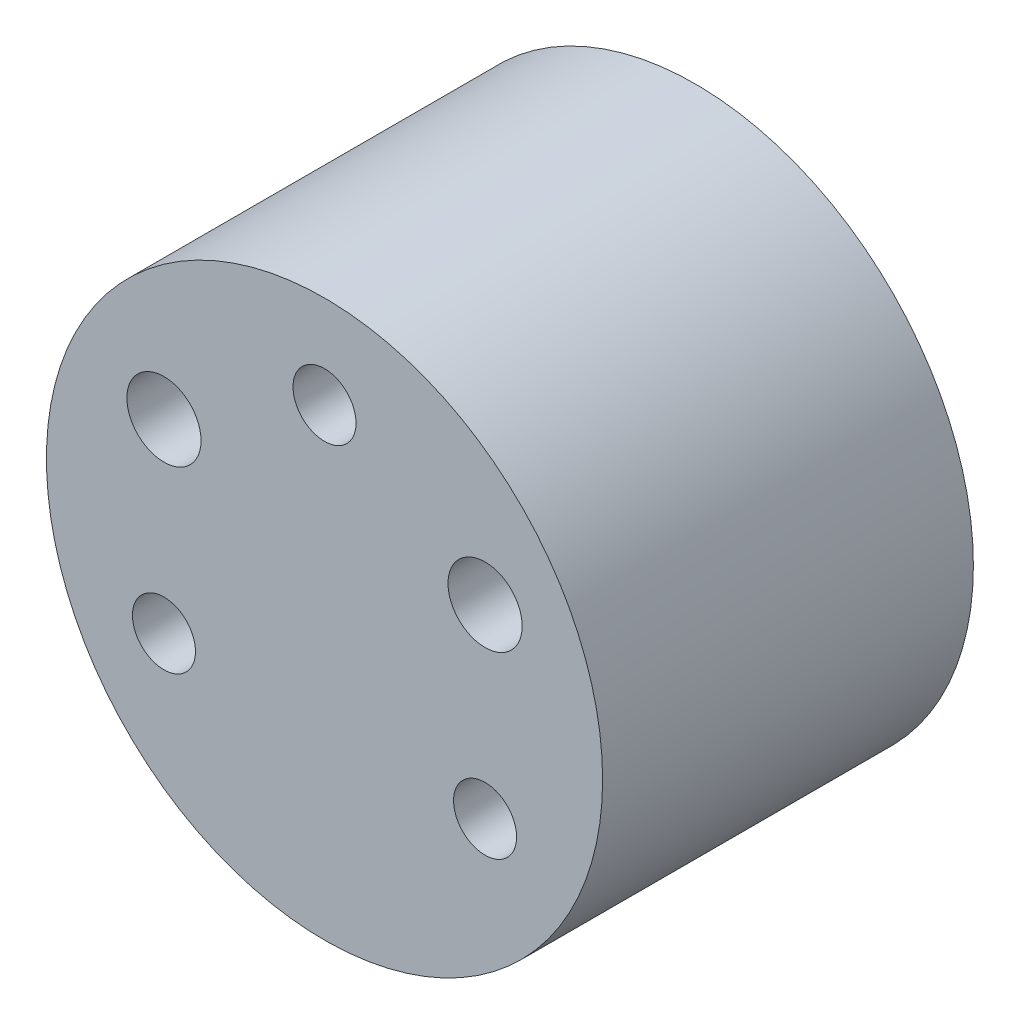
from build123d import *

# Parameters (mm, degrees)
ESBO_O1_R                   = 30
RESSALTO_EXTRUS_O1_DEPTH    = 40
FURO_ROSCADO_DE_M81_D       = 6.8
FURO_ROSCADO_DE_M81_DEPTH   = 30
FURO_ROSCADO_DE_M81_TIP     = 2.042926105
FUROS_GUIA_COM_8_0MM1_D     = 8
FUROS_GUIA_COM_8_0MM1_DEPTH = 30
FUROS_GUIA_COM_8_0MM1_TIP   = 2.403442476


with BuildPart() as part:
    # Esboço1 → Ressalto-extrusão1 (new body)
    with BuildSketch(Plane.XY):
        with Locations((0, 235)):
            Circle(ESBO_O1_R)
    extrude(amount=RESSALTO_EXTRUS_O1_DEPTH)

    # Furo roscado de M81
    with Locations(Plane.XY.offset(40)):
        with Locations((-17.320508076, 225), (0, 255), (17.320508076, 225)):
            Hole(FURO_ROSCADO_DE_M81_D / 2, depth=FURO_ROSCADO_DE_M81_DEPTH)
            with Locations((0, 0, -(FURO_ROSCADO_DE_M81_DEPTH + FURO_ROSCADO_DE_M81_TIP / 2))):  # 118° drill point
                Cone(0, FURO_ROSCADO_DE_M81_D / 2, FURO_ROSCADO_DE_M81_TIP, mode=Mode.SUBTRACT)

    # Furos-guia com Ø8.0mm1
    with Locations(Plane.XY.offset(40)):
        with Locations((17.320508076, 245), (-17.320508076, 245)):
            Hole(FUROS_GUIA_COM_8_0MM1_D / 2, depth=FUROS_GUIA_COM_8_0MM1_DEPTH)
            with Locations((0, 0, -(FUROS_GUIA_COM_8_0MM1_DEPTH + FUROS_GUIA_COM_8_0MM1_TIP / 2))):  # 118° drill point
                Cone(0, FUROS_GUIA_COM_8_0MM1_D / 2, FUROS_GUIA_COM_8_0MM1_TIP, mode=Mode.SUBTRACT)


solid = part.part
